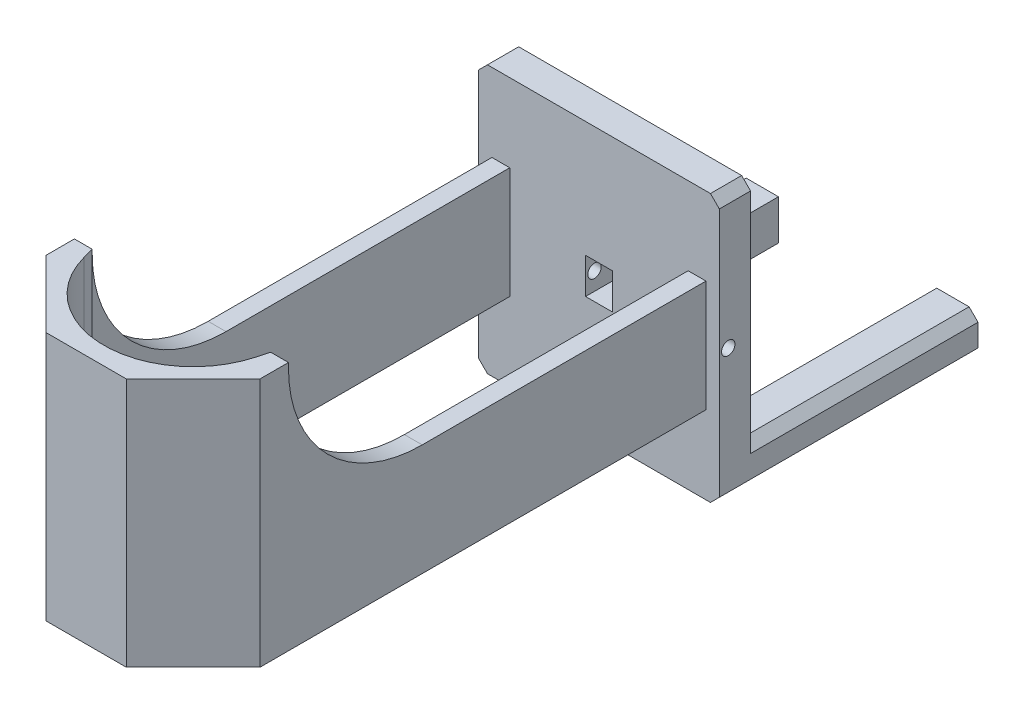
from build123d import *

# Parameters (mm, degrees)
BOSS_EXTRUDE1_DEPTH      = 5
BOSS_EXTRUDE2_DEPTH      = 56
BOSS_EXTRUDE2_2_DEPTH    = 56
BOSS_EXTRUDE3_DEPTH      = 2
BOSS_EXTRUDE3_DEPTH_BACK = 5
SKETCH9_W                = 6
SKETCH9_H                = 8
CUT_EXTRUDE3_DEPTH       = 6
CUT_EXTRUDE4_DEPTH       = 85.267431431
CUT_EXTRUDE4_DEPTH_BACK  = 85.267431431
SKETCH10_R               = 1.5
BOSS_EXTRUDE4_DEPTH      = 43.5
BOSS_EXTRUDE4_DEPTH_BACK = 12.5
SKETCH11_W               = 48
SKETCH11_H               = 115
CUT_EXTRUDE5_DEPTH       = 153.322847925
CUT_EXTRUDE6_DEPTH       = 145.966375412
CUT_EXTRUDE6_DEPTH_BACK  = 145.966375412
CHAMFER1_SIZE            = 15
CHAMFER2_SIZE            = 15


with BuildPart() as part:
    # Sketch1 → Boss-Extrude1 (new body)
    with BuildSketch(Plane.XY):
        Polygon((37.6, 51), (52, 51), (54, 53), (54, 58), (52, 60), (2, 60), (0, 58), (0, 53), (2, 51), (16.4, 51), align=None)
    extrude(amount=BOSS_EXTRUDE1_DEPTH)



with BuildPart() as body_2:
    # Sketch2 → Boss-Extrude2 (new body)
    with BuildSketch(Plane.XY.offset(-51)):
        Polygon((0, 7), (0, 2), (2, 0), (9.25, 0), (9.25, 9), (2, 9), align=None)
    extrude(amount=BOSS_EXTRUDE2_DEPTH)


with BuildPart() as body_3:
    # Sketch2 → Boss-Extrude2 2 (new body)
    with BuildSketch(Plane.XY.offset(-51)):
        Polygon((54, 2), (54, 7), (52, 9), (44.75, 9), (44.75, 0), (52, 0), align=None)
    extrude(amount=BOSS_EXTRUDE2_2_DEPTH)


with BuildPart() as part_1:
    add(part.part)

    add(body_2.part)  # Boss-Extrude3 merges body 2

    add(body_3.part)  # Boss-Extrude3 merges body 3
    # Sketch8 → Boss-Extrude3 (add, two sides: drawn at the far end of the back side and taken through both)
    with BuildSketch(Plane.XY.offset(5).offset(-BOSS_EXTRUDE3_DEPTH_BACK)):
        Polygon((0, 2), (0, 58), (2, 60), (52, 60), (54, 58), (54, 2), (52, 0), (2, 0), align=None)
    extrude(amount=BOSS_EXTRUDE3_DEPTH + BOSS_EXTRUDE3_DEPTH_BACK)

    # Sketch9 → Cut-Extrude3 (cut)
    with BuildSketch(Plane.XY.offset(7)):
        with Locations((27, 30)):
            Rectangle(SKETCH9_W, SKETCH9_H)
    extrude(amount=-CUT_EXTRUDE3_DEPTH, mode=Mode.SUBTRACT)

    # Sketch10 → Cut-Extrude4 (cut, two sides: drawn at the far end of the back side and taken through both)
    with BuildSketch(Plane.ZY.offset(-30).offset(-CUT_EXTRUDE4_DEPTH_BACK)):
        with Locations(Location((5, 30, 0), (0, 0, 270))):
            Circle(SKETCH10_R)
    extrude(amount=CUT_EXTRUDE4_DEPTH + CUT_EXTRUDE4_DEPTH_BACK, mode=Mode.SUBTRACT)

    # Sketch11 → Boss-Extrude4 (add, two sides: drawn at the far end of the back side and taken through both)
    with BuildSketch(Plane(origin=(0, 30, 0), x_dir=(1, 0, 0), z_dir=(0, 1, 0)).offset(-BOSS_EXTRUDE4_DEPTH_BACK)):
        with Locations((27, -64.5)):
            Rectangle(SKETCH11_W, SKETCH11_H)
    extrude(amount=BOSS_EXTRUDE4_DEPTH + BOSS_EXTRUDE4_DEPTH_BACK)

    # Sketch12 → Cut-Extrude5 (cut, through all)
    with BuildSketch(Plane(origin=(0, 73.5, 0), x_dir=(1, 0, 0), z_dir=(0, 1, 0))):
        with BuildLine():
            Line((7, -100.633049952), (7, -7))
            Line((7, -7), (47, -7))
            Line((47, -7), (47, -100.633049952))
            Line((47, -100.633049952), (46.318516526, -103.176380902))
            ThreePointArc((46.318516526, -103.176380902), (27, -118), (7.681483474, -103.176380902))
            Line((7.681483474, -103.176380902), (7, -100.633049952))
        make_face()
    extrude(amount=-CUT_EXTRUDE5_DEPTH, mode=Mode.SUBTRACT)

    # Sketch13 → Cut-Extrude6 (cut, two sides: drawn at the far end of the back side and taken through both)
    with BuildSketch(Plane(origin=(27, 0, 0), x_dir=(0, 0, -1), z_dir=(1, 0, 0)).offset(-CUT_EXTRUDE6_DEPTH_BACK)):
        with BuildLine():
            Line((-7, 42.5), (-70.633049952, 42.5))
            ThreePointArc((-70.633049952, 42.5), (-91.846253387, 51.286796564), (-100.633049952, 72.5))
            Line((-100.633049952, 72.5), (-100.633049952, 73.5))
            Line((-100.633049952, 73.5), (-7, 73.5))
            Line((-7, 73.5), (-7, 42.5))
        make_face()
    extrude(amount=CUT_EXTRUDE6_DEPTH + CUT_EXTRUDE6_DEPTH_BACK, mode=Mode.SUBTRACT)

    # Chamfer1
    chamfer1_edges = [part_1.edges().sort_by_distance(p)[0] for p in [
        (3, 45.5, 122),
    ]]
    chamfer(chamfer1_edges, length=CHAMFER1_SIZE)

    # Chamfer2
    chamfer2_edges = [part_1.edges().sort_by_distance(p)[0] for p in [
        (51, 45.5, 122),
    ]]
    chamfer(chamfer2_edges, length=CHAMFER2_SIZE)


solid = part_1.part
